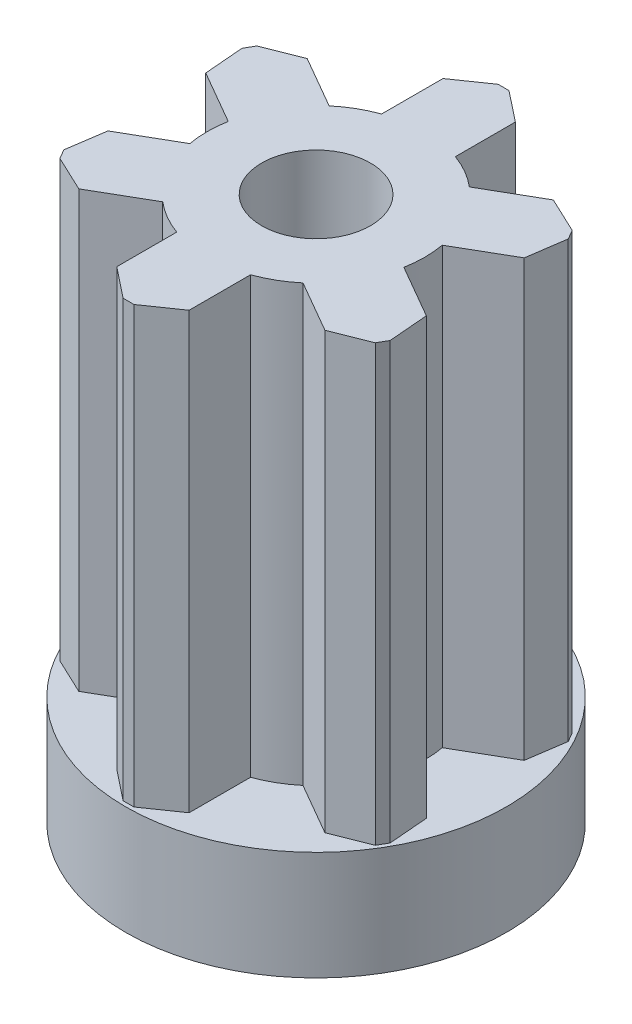
from build123d import *

# Parameters (mm, degrees)
SKETCH1_R           = 1.75
BOSS_EXTRUDE1_DEPTH = 1
BOSS_EXTRUDE4_DEPTH = 4
SKETCH2_R           = 1
BOSS_EXTRUDE5_DEPTH = 4
CIRPATTERN1_COUNT   = 6
SKETCH4_R           = 0.5
CUT_EXTRUDE1_DEPTH  = 6.578978401


with BuildPart() as part:
    # Sketch1 → Boss-Extrude1 (new body)
    with BuildSketch(Plane(origin=(0, 0, 0), x_dir=(1, 0, 0), z_dir=(0, 1, 0))):
        with Locations(Location((0, 0, 0), (0, 0, 270))):
            Circle(SKETCH1_R)
    extrude(amount=BOSS_EXTRUDE1_DEPTH)

    # Sketch3 → Boss-Extrude4 (add)
    with BuildSketch(Plane(origin=(0, 1, 0), x_dir=(1, 0, 0), z_dir=(0, 1, 0))):
        Polygon((-0.338769463, 0.925294488), (-0.338769463, 1.505565336), (-0.039378585, 1.713038111), (0.060390246, 1.713038111), (0.34, 1.491585005), (0.34, 0.925294488), align=None)
    boss_extrude4 = extrude(amount=BOSS_EXTRUDE4_DEPTH)

    # Sketch2 → Boss-Extrude5 (add)
    with BuildSketch(Plane(origin=(0, 1, 0), x_dir=(1, 0, 0), z_dir=(0, 1, 0))):
        Circle(SKETCH2_R)
    extrude(amount=BOSS_EXTRUDE5_DEPTH)

    # CirPattern1: Boss-Extrude4 ×6 about axis
    cirpattern1_axis = Axis((0, 0, 0), (0, 1, 0))
    for i in range(1, CIRPATTERN1_COUNT):
        add(boss_extrude4.rotate(cirpattern1_axis, i * 360 / CIRPATTERN1_COUNT))

    # Sketch4 → Cut-Extrude1 (cut, through all)
    with BuildSketch(Plane(origin=(0, 5, 0), x_dir=(1, 0, 0), z_dir=(0, 1, 0))):
        with Locations(Location((0, 0, 0), (0, 0, 270))):
            Circle(SKETCH4_R)
    extrude(amount=-CUT_EXTRUDE1_DEPTH, mode=Mode.SUBTRACT)


solid = part.part
